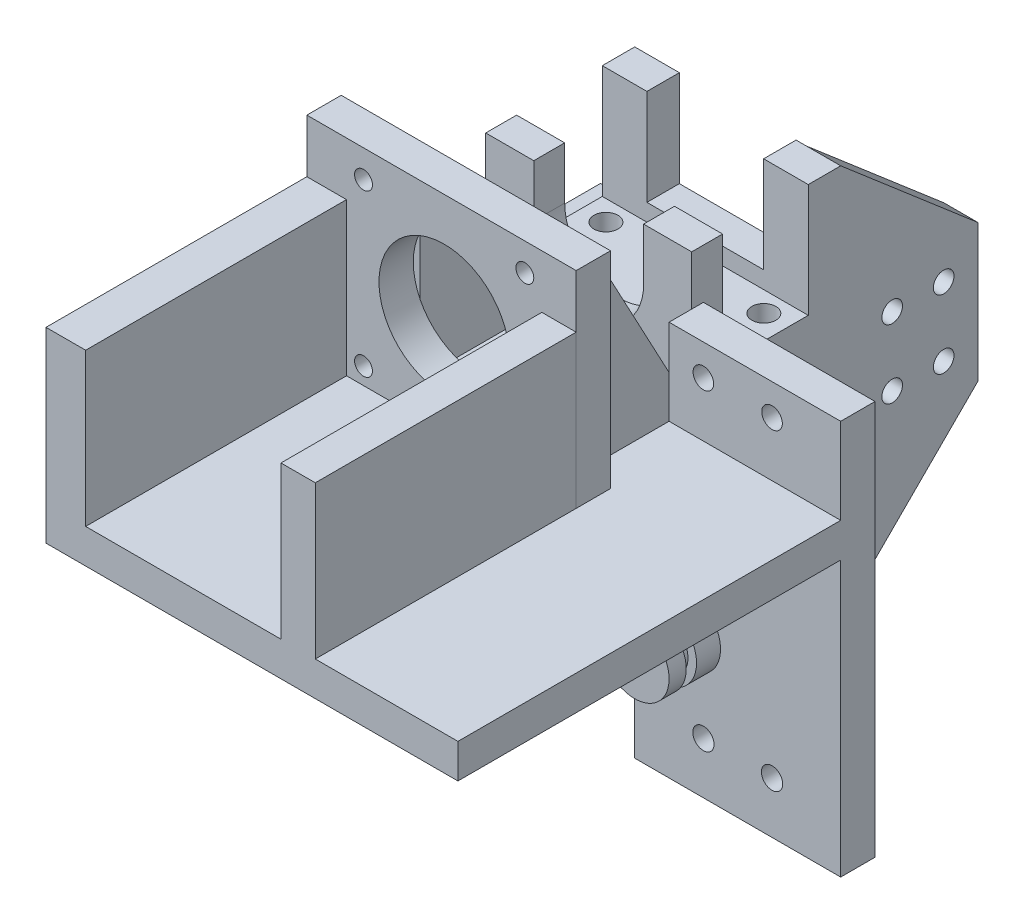
from build123d import *

# Parameters (mm, degrees)
BOSS_EXTRUDE1_DEPTH  = 10
SKETCH2_W            = 60
SKETCH2_H            = 25
BOSS_EXTRUDE2_DEPTH  = 6.45
SKETCH3_W            = 60
SKETCH3_H            = 9.45
BOSS_EXTRUDE3_DEPTH  = 39.45
SKETCH4_W            = 34
SKETCH4_H            = 28
CUT_EXTRUDE1_DEPTH   = 9.45
SKETCH5_W            = 60
SKETCH5_H            = 9
BOSS_EXTRUDE4_DEPTH  = 39.45
CUT_EXTRUDE2_REACH   = 170.798
BOSS_EXTRUDE5_DEPTH  = 80
SKETCH8_W            = 75.99709589
SKETCH8_H            = 54.458409134
BOSS_EXTRUDE6_DEPTH  = 10
SKETCH9_W            = 10
SKETCH9_H            = 75.99709589
BOSS_EXTRUDE7_DEPTH  = 44.46
SKETCH17_W           = 78.45
SKETCH17_H           = 10
BOSS_EXTRUDE27_DEPTH = 60
SKETCH19_W           = 2.5
SKETCH19_H           = 60
BOSS_EXTRUDE31_DEPTH = 32
SKETCH20_W           = 75.99709589
SKETCH20_H           = 44.458409134
BOSS_EXTRUDE32_DEPTH = 1.55
SKETCH21_R           = 2.6
SKETCH21_R_2         = 19
CUT_EXTRUDE3_DEPTH   = 10
CUT_EXTRUDE4_REACH   = 213.153
SKETCH22_R           = 3.5
CUT_EXTRUDE5_REACH   = 191.962
SKETCH23_W           = 27
SKETCH23_H           = 6
CUT_EXTRUDE6_REACH   = 191.962
SKETCH24_R           = 3.1
CUT_EXTRUDE7_REACH   = 177.882
SKETCH25_R           = 3.1
CUT_EXTRUDE10_DEPTH  = 70
SKETCH27_W           = 50
SKETCH27_H           = 10
BOSS_EXTRUDE33_DEPTH = 25
CUT_EXTRUDE11_REACH  = 177.882
SKETCH28_R           = 3
SKETCH29_W           = 10
SKETCH29_H           = 40
BOSS_EXTRUDE34_DEPTH = 40
CUT_EXTRUDE12_REACH  = 226.958
SKETCH30_R           = 3
BOSS_EXTRUDE35_DEPTH = 10
SKETCH32_R           = 10
BOSS_EXTRUDE36_DEPTH = 15
CUT_EXTRUDE14_START  = -8
SKETCH33_R           = 10
SKETCH33_R_2         = 7.5
CUT_EXTRUDE14_DEPTH  = 3
SKETCH34_W           = 85.51
SKETCH34_H           = 10
BOSS_EXTRUDE37_DEPTH = 10
SKETCH35_R           = 10
BOSS_EXTRUDE38_DEPTH = 15
CUT_EXTRUDE15_START  = -8
SKETCH37_R           = 10
SKETCH37_R_2         = 7.5
CUT_EXTRUDE15_DEPTH  = 3


with BuildPart() as part:
    # Sketch1 → Boss-Extrude1 (new body)
    with BuildSketch(Plane(origin=(0, 0, 0), x_dir=(1, 0, 0), z_dir=(0, 1, 0))):
        Polygon((0, 0), (0, 161.51), (60, 161.51), (60, 121.51), (110, 121.51), (110, 0), align=None)
    extrude(amount=BOSS_EXTRUDE1_DEPTH)

    # Sketch2 → Boss-Extrude2 (add)
    with BuildSketch(Plane(origin=(0, 10, 0), x_dir=(1, 0, 0), z_dir=(0, 1, 0))):
        with Locations((30, 139.6)):
            Rectangle(SKETCH2_W, SKETCH2_H)
    extrude(amount=BOSS_EXTRUDE2_DEPTH)

    # Sketch3 → Boss-Extrude3 (add)
    with BuildSketch(Plane(origin=(0, 10, 0), x_dir=(1, 0, 0), z_dir=(0, 1, 0))):
        with Locations((30, 156.785)):
            Rectangle(SKETCH3_W, SKETCH3_H)
    extrude(amount=BOSS_EXTRUDE3_DEPTH)

    # Sketch4 → Cut-Extrude1 (cut)
    with BuildSketch(Plane(origin=(0, 0, -161.51), x_dir=(-1, 0, 0), z_dir=(0, 0, -1))):
        with Locations((-30, 35.45)):
            Rectangle(SKETCH4_W, SKETCH4_H)
    extrude(amount=-CUT_EXTRUDE1_DEPTH, mode=Mode.SUBTRACT)

    # Sketch5 → Boss-Extrude4 (add)
    with BuildSketch(Plane(origin=(0, 10, 0), x_dir=(1, 0, 0), z_dir=(0, 1, 0))):
        with Locations((30, 122.6)):
            Rectangle(SKETCH5_W, SKETCH5_H)
    extrude(amount=BOSS_EXTRUDE4_DEPTH)

    # Sketch6 → Cut-Extrude2 (cut, up to next)
    with BuildSketch(Plane.XY.offset(-118.1), mode=Mode.PRIVATE) as cut_extrude2_sk1:
        with BuildLine():
            Line((14, 34.24), (14, 49.45))
            Line((14, 49.45), (46, 49.45))
            Line((46, 49.45), (46, 34.24))
            ThreePointArc((46, 34.24), (30, 18.24), (14, 34.24))
        make_face()
    cut_extrude2_tool1 = extrude(cut_extrude2_sk1.sketch, amount=-CUT_EXTRUDE2_REACH, mode=Mode.PRIVATE) & part.part
    add(cut_extrude2_tool1.solids().sort_by_distance((30, 35.332249, -118.1))[0], mode=Mode.SUBTRACT)

    # Sketch7 → Boss-Extrude5 (add)
    with BuildSketch(Plane.XZ):
        Polygon((110, -111.51), (50, -111.51), (50, -161.51), (60, -161.51), (60, -121.51), (110, -121.51), align=None)
    extrude(amount=BOSS_EXTRUDE5_DEPTH)

    # Sketch8 → Boss-Extrude6 (add)
    with BuildSketch(Plane.ZY):
        with Locations((-37.998547945, 27.229204567)):
            Rectangle(SKETCH8_W, SKETCH8_H)
    extrude(amount=BOSS_EXTRUDE6_DEPTH)

    # Sketch9 → Boss-Extrude7 (add)
    with BuildSketch(Plane(origin=(0, 10, 0), x_dir=(1, 0, 0), z_dir=(0, 1, 0))):
        with Locations((63.45, 37.998547945)):
            Rectangle(SKETCH9_W, SKETCH9_H)
    extrude(amount=BOSS_EXTRUDE7_DEPTH)

    # Sketch17 → Boss-Extrude27 (add)
    with BuildSketch(Plane(origin=(0, 10, 0), x_dir=(1, 0, 0), z_dir=(0, 1, 0))):
        with Locations((29.225, 81)):
            Rectangle(SKETCH17_W, SKETCH17_H)
    extrude(amount=BOSS_EXTRUDE27_DEPTH)

    # Sketch19 → Boss-Extrude31 (add)
    with BuildSketch(Plane(origin=(0, 0, -86), x_dir=(-1, 0, 0), z_dir=(0, 0, -1))):
        with Locations((-1.25, 40)):
            Rectangle(SKETCH19_W, SKETCH19_H)
        with Locations((-11.75, 40)):
            Rectangle(SKETCH19_W, SKETCH19_H)
        with Locations((-48.25, 40)):
            Rectangle(SKETCH19_W, SKETCH19_H)
        with Locations((-58.75, 40)):
            Rectangle(SKETCH19_W, SKETCH19_H)
    extrude(amount=BOSS_EXTRUDE31_DEPTH)

    # Sketch20 → Boss-Extrude32 (add)
    with BuildSketch(Plane(origin=(0, 0, 0), x_dir=(0, 0, -1), z_dir=(1, 0, 0))):
        with Locations((37.998547945, 32.229204567)):
            Rectangle(SKETCH20_W, SKETCH20_H)
    extrude(amount=BOSS_EXTRUDE32_DEPTH)

    # Sketch21 → Cut-Extrude3 (cut)
    with BuildSketch(Plane.XY.offset(-76)):
        with Locations((6.5, 61.95)):
            Circle(SKETCH21_R)
        with Locations((53.5, 61.95)):
            Circle(SKETCH21_R)
        with Locations((53.5, 14.95)):
            Circle(SKETCH21_R)
        with Locations((6.5, 14.95)):
            Circle(SKETCH21_R)
        with Locations((30, 38.45)):
            Circle(SKETCH21_R_2)
    extrude(amount=-CUT_EXTRUDE3_DEPTH, mode=Mode.SUBTRACT)

    # Sketch22 → Cut-Extrude4 (cut, up to next)
    with BuildSketch(Plane.XZ, mode=Mode.PRIVATE) as cut_extrude4_sk1:
        with Locations(Location((7.02, -146.1, 0), (0, 0, 270))):
            Circle(SKETCH22_R)
    cut_extrude4_tool1 = extrude(cut_extrude4_sk1.sketch, amount=-CUT_EXTRUDE4_REACH, mode=Mode.PRIVATE) & part.part
    # Sketch22 → Cut-Extrude4 (cut, up to next)
    with BuildSketch(Plane.XZ, mode=Mode.PRIVATE) as cut_extrude4_sk2:
        with Locations(Location((7.02, -133, 0), (0, 0, 270))):
            Circle(SKETCH22_R)
    cut_extrude4_tool2 = extrude(cut_extrude4_sk2.sketch, amount=-CUT_EXTRUDE4_REACH, mode=Mode.PRIVATE) & part.part
    # Sketch22 → Cut-Extrude4 (cut, up to next)
    with BuildSketch(Plane.XZ, mode=Mode.PRIVATE) as cut_extrude4_sk3:
        with Locations(Location((53.02, -146.1, 0), (0, 0, 210.361087599))):
            Circle(SKETCH22_R)
    cut_extrude4_tool3 = extrude(cut_extrude4_sk3.sketch, amount=-CUT_EXTRUDE4_REACH, mode=Mode.PRIVATE) & part.part
    # Sketch22 → Cut-Extrude4 (cut, up to next)
    with BuildSketch(Plane.XZ, mode=Mode.PRIVATE) as cut_extrude4_sk4:
        with Locations(Location((53.02, -133, 0), (0, 0, 210.361087599))):
            Circle(SKETCH22_R)
    cut_extrude4_tool4 = extrude(cut_extrude4_sk4.sketch, amount=-CUT_EXTRUDE4_REACH, mode=Mode.PRIVATE) & part.part
    add(cut_extrude4_tool1.solids().sort_by_distance((7.02, 0, -146.1))[0], mode=Mode.SUBTRACT)
    add(cut_extrude4_tool2.solids().sort_by_distance((7.02, 0, -133))[0], mode=Mode.SUBTRACT)
    add(cut_extrude4_tool3.solids().sort_by_distance((53.02, 0, -146.1))[0], mode=Mode.SUBTRACT)
    add(cut_extrude4_tool4.solids().sort_by_distance((53.02, 0, -133))[0], mode=Mode.SUBTRACT)

    # Sketch23 → Cut-Extrude5 (cut, up to next)
    with BuildSketch(Plane.ZY.offset(-50), mode=Mode.PRIVATE) as cut_extrude5_sk1:
        with Locations((-139.6, -3)):
            Rectangle(SKETCH23_W, SKETCH23_H)
    cut_extrude5_tool1 = extrude(cut_extrude5_sk1.sketch, amount=-CUT_EXTRUDE5_REACH, mode=Mode.PRIVATE) & part.part
    add(cut_extrude5_tool1.solids().sort_by_distance((50, -3, -139.6))[0], mode=Mode.SUBTRACT)

    # Sketch24 → Cut-Extrude6 (cut, up to next)
    with BuildSketch(Plane.ZY.offset(-50), mode=Mode.PRIVATE) as cut_extrude6_sk1:
        with Locations((-151.51, -15)):
            Circle(SKETCH24_R)
    cut_extrude6_tool1 = extrude(cut_extrude6_sk1.sketch, amount=-CUT_EXTRUDE6_REACH, mode=Mode.PRIVATE) & part.part
    # Sketch24 → Cut-Extrude6 (cut, up to next)
    with BuildSketch(Plane.ZY.offset(-50), mode=Mode.PRIVATE) as cut_extrude6_sk2:
        with Locations((-151.51, -65)):
            Circle(SKETCH24_R)
    cut_extrude6_tool2 = extrude(cut_extrude6_sk2.sketch, amount=-CUT_EXTRUDE6_REACH, mode=Mode.PRIVATE) & part.part
    # Sketch24 → Cut-Extrude6 (cut, up to next)
    with BuildSketch(Plane.ZY.offset(-50), mode=Mode.PRIVATE) as cut_extrude6_sk3:
        with Locations((-131.51, -15)):
            Circle(SKETCH24_R)
    cut_extrude6_tool3 = extrude(cut_extrude6_sk3.sketch, amount=-CUT_EXTRUDE6_REACH, mode=Mode.PRIVATE) & part.part
    # Sketch24 → Cut-Extrude6 (cut, up to next)
    with BuildSketch(Plane.ZY.offset(-50), mode=Mode.PRIVATE) as cut_extrude6_sk4:
        with Locations((-131.51, -65)):
            Circle(SKETCH24_R)
    cut_extrude6_tool4 = extrude(cut_extrude6_sk4.sketch, amount=-CUT_EXTRUDE6_REACH, mode=Mode.PRIVATE) & part.part
    add(cut_extrude6_tool1.solids().sort_by_distance((50, -15, -151.51))[0], mode=Mode.SUBTRACT)
    add(cut_extrude6_tool2.solids().sort_by_distance((50, -65, -151.51))[0], mode=Mode.SUBTRACT)
    add(cut_extrude6_tool3.solids().sort_by_distance((50, -15, -131.51))[0], mode=Mode.SUBTRACT)
    add(cut_extrude6_tool4.solids().sort_by_distance((50, -65, -131.51))[0], mode=Mode.SUBTRACT)

    # Sketch25 → Cut-Extrude7 (cut, up to next)
    with BuildSketch(Plane.XY.offset(-111.51), mode=Mode.PRIVATE) as cut_extrude7_sk1:
        with Locations((70, -15)):
            Circle(SKETCH25_R)
    cut_extrude7_tool1 = extrude(cut_extrude7_sk1.sketch, amount=-CUT_EXTRUDE7_REACH, mode=Mode.PRIVATE) & part.part
    # Sketch25 → Cut-Extrude7 (cut, up to next)
    with BuildSketch(Plane.XY.offset(-111.51), mode=Mode.PRIVATE) as cut_extrude7_sk2:
        with Locations((90, -15)):
            Circle(SKETCH25_R)
    cut_extrude7_tool2 = extrude(cut_extrude7_sk2.sketch, amount=-CUT_EXTRUDE7_REACH, mode=Mode.PRIVATE) & part.part
    # Sketch25 → Cut-Extrude7 (cut, up to next)
    with BuildSketch(Plane.XY.offset(-111.51), mode=Mode.PRIVATE) as cut_extrude7_sk3:
        with Locations((70, -65)):
            Circle(SKETCH25_R)
    cut_extrude7_tool3 = extrude(cut_extrude7_sk3.sketch, amount=-CUT_EXTRUDE7_REACH, mode=Mode.PRIVATE) & part.part
    # Sketch25 → Cut-Extrude7 (cut, up to next)
    with BuildSketch(Plane.XY.offset(-111.51), mode=Mode.PRIVATE) as cut_extrude7_sk4:
        with Locations((90, -65)):
            Circle(SKETCH25_R)
    cut_extrude7_tool4 = extrude(cut_extrude7_sk4.sketch, amount=-CUT_EXTRUDE7_REACH, mode=Mode.PRIVATE) & part.part
    add(cut_extrude7_tool1.solids().sort_by_distance((70, -15, -111.51))[0], mode=Mode.SUBTRACT)
    add(cut_extrude7_tool2.solids().sort_by_distance((90, -15, -111.51))[0], mode=Mode.SUBTRACT)
    add(cut_extrude7_tool3.solids().sort_by_distance((70, -65, -111.51))[0], mode=Mode.SUBTRACT)
    add(cut_extrude7_tool4.solids().sort_by_distance((90, -65, -111.51))[0], mode=Mode.SUBTRACT)

    # Sketch26 → Cut-Extrude10 (cut)
    with BuildSketch(Plane.ZY):
        Polygon((-118.1, 10), (-86, 70), (-118, 70), align=None)
    extrude(amount=-CUT_EXTRUDE10_DEPTH, mode=Mode.SUBTRACT)

    # Sketch27 → Boss-Extrude33 (add)
    with BuildSketch(Plane(origin=(0, 10, 0), x_dir=(1, 0, 0), z_dir=(0, 1, 0))):
        with Locations((85, 116.51)):
            Rectangle(SKETCH27_W, SKETCH27_H)
    extrude(amount=BOSS_EXTRUDE33_DEPTH)

    # Sketch28 → Cut-Extrude11 (cut, up to next)
    with BuildSketch(Plane.XY.offset(-111.51), mode=Mode.PRIVATE) as cut_extrude11_sk1:
        with Locations((90, 25.935)):
            Circle(SKETCH28_R)
    cut_extrude11_tool1 = extrude(cut_extrude11_sk1.sketch, amount=-CUT_EXTRUDE11_REACH, mode=Mode.PRIVATE) & part.part
    # Sketch28 → Cut-Extrude11 (cut, up to next)
    with BuildSketch(Plane.XY.offset(-111.51), mode=Mode.PRIVATE) as cut_extrude11_sk2:
        with Locations((70, 25.935)):
            Circle(SKETCH28_R)
    cut_extrude11_tool2 = extrude(cut_extrude11_sk2.sketch, amount=-CUT_EXTRUDE11_REACH, mode=Mode.PRIVATE) & part.part
    add(cut_extrude11_tool1.solids().sort_by_distance((90, 25.935, -111.51))[0], mode=Mode.SUBTRACT)
    add(cut_extrude11_tool2.solids().sort_by_distance((70, 25.935, -111.51))[0], mode=Mode.SUBTRACT)

    # Sketch29 → Boss-Extrude34 (add)
    with BuildSketch(Plane(origin=(0, 0, -161.51), x_dir=(-1, 0, 0), z_dir=(0, 0, -1))):
        with Locations((-55, -4.85)):
            Rectangle(SKETCH29_W, SKETCH29_H)
    extrude(amount=BOSS_EXTRUDE34_DEPTH)

    # Sketch30 → Cut-Extrude12 (cut, up to next)
    with BuildSketch(Plane.ZY.offset(-50), mode=Mode.PRIVATE) as cut_extrude12_sk1:
        with Locations((-191.51, 5.15)):
            Circle(SKETCH30_R)
    cut_extrude12_tool1 = extrude(cut_extrude12_sk1.sketch, amount=-CUT_EXTRUDE12_REACH, mode=Mode.PRIVATE) & part.part
    # Sketch30 → Cut-Extrude12 (cut, up to next)
    with BuildSketch(Plane.ZY.offset(-50), mode=Mode.PRIVATE) as cut_extrude12_sk2:
        with Locations((-176.51, 5.15)):
            Circle(SKETCH30_R)
    cut_extrude12_tool2 = extrude(cut_extrude12_sk2.sketch, amount=-CUT_EXTRUDE12_REACH, mode=Mode.PRIVATE) & part.part
    # Sketch30 → Cut-Extrude12 (cut, up to next)
    with BuildSketch(Plane.ZY.offset(-50), mode=Mode.PRIVATE) as cut_extrude12_sk3:
        with Locations((-191.51, -14.85)):
            Circle(SKETCH30_R)
    cut_extrude12_tool3 = extrude(cut_extrude12_sk3.sketch, amount=-CUT_EXTRUDE12_REACH, mode=Mode.PRIVATE) & part.part
    # Sketch30 → Cut-Extrude12 (cut, up to next)
    with BuildSketch(Plane.ZY.offset(-50), mode=Mode.PRIVATE) as cut_extrude12_sk4:
        with Locations((-176.51, -14.85)):
            Circle(SKETCH30_R)
    cut_extrude12_tool4 = extrude(cut_extrude12_sk4.sketch, amount=-CUT_EXTRUDE12_REACH, mode=Mode.PRIVATE) & part.part
    add(cut_extrude12_tool1.solids().sort_by_distance((50, 5.15, -191.51))[0], mode=Mode.SUBTRACT)
    add(cut_extrude12_tool2.solids().sort_by_distance((50, 5.15, -176.51))[0], mode=Mode.SUBTRACT)
    add(cut_extrude12_tool3.solids().sort_by_distance((50, -14.85, -191.51))[0], mode=Mode.SUBTRACT)
    add(cut_extrude12_tool4.solids().sort_by_distance((50, -14.85, -176.51))[0], mode=Mode.SUBTRACT)

    # Sketch31 → Boss-Extrude35 (add)
    with BuildSketch(Plane.ZY.offset(-50)):
        Polygon((-161.51, 15.15), (-161.51, 49.45), (-201.51, 15.15), align=None)
        Polygon((-161.51, -24.85), (-201.51, -24.85), (-161.51, -64.85), align=None)
    extrude(amount=-BOSS_EXTRUDE35_DEPTH)

    # Sketch32 → Boss-Extrude36 (add)
    with BuildSketch(Plane.ZY.offset(-50)):
        with Locations(Location((-126.51, -40, 0), (0, 0, 180))):
            Circle(SKETCH32_R)
    extrude(amount=BOSS_EXTRUDE36_DEPTH)

    # Sketch33 → Cut-Extrude14 (cut)
    with BuildSketch(Plane.ZY.offset(-35).offset(CUT_EXTRUDE14_START)):
        with Locations(Location((-126.51, -40, 0), (0, 0, 180))):
            Circle(SKETCH33_R)
        with Locations((-126.51, -40)):
            Circle(SKETCH33_R_2, mode=Mode.SUBTRACT)
    extrude(amount=CUT_EXTRUDE14_DEPTH, mode=Mode.SUBTRACT)

    # Sketch34 → Boss-Extrude37 (add)
    with BuildSketch(Plane.ZY):
        with Locations((-118.755, 5)):
            Rectangle(SKETCH34_W, SKETCH34_H)
    extrude(amount=BOSS_EXTRUDE37_DEPTH)

    # Sketch35 → Boss-Extrude38 (add)
    with BuildSketch(Plane.XY.offset(-111.51)):
        with Locations(Location((65, -40, 0), (0, 0, 180))):
            Circle(SKETCH35_R)
    extrude(amount=BOSS_EXTRUDE38_DEPTH)

    # Sketch37 → Cut-Extrude15 (cut)
    with BuildSketch(Plane.XY.offset(-96.51).offset(CUT_EXTRUDE15_START)):
        with Locations(Location((65, -40, 0), (0, 0, 180))):
            Circle(SKETCH37_R)
        with Locations((65, -40)):
            Circle(SKETCH37_R_2, mode=Mode.SUBTRACT)
    extrude(amount=CUT_EXTRUDE15_DEPTH, mode=Mode.SUBTRACT)


solid = part.part
